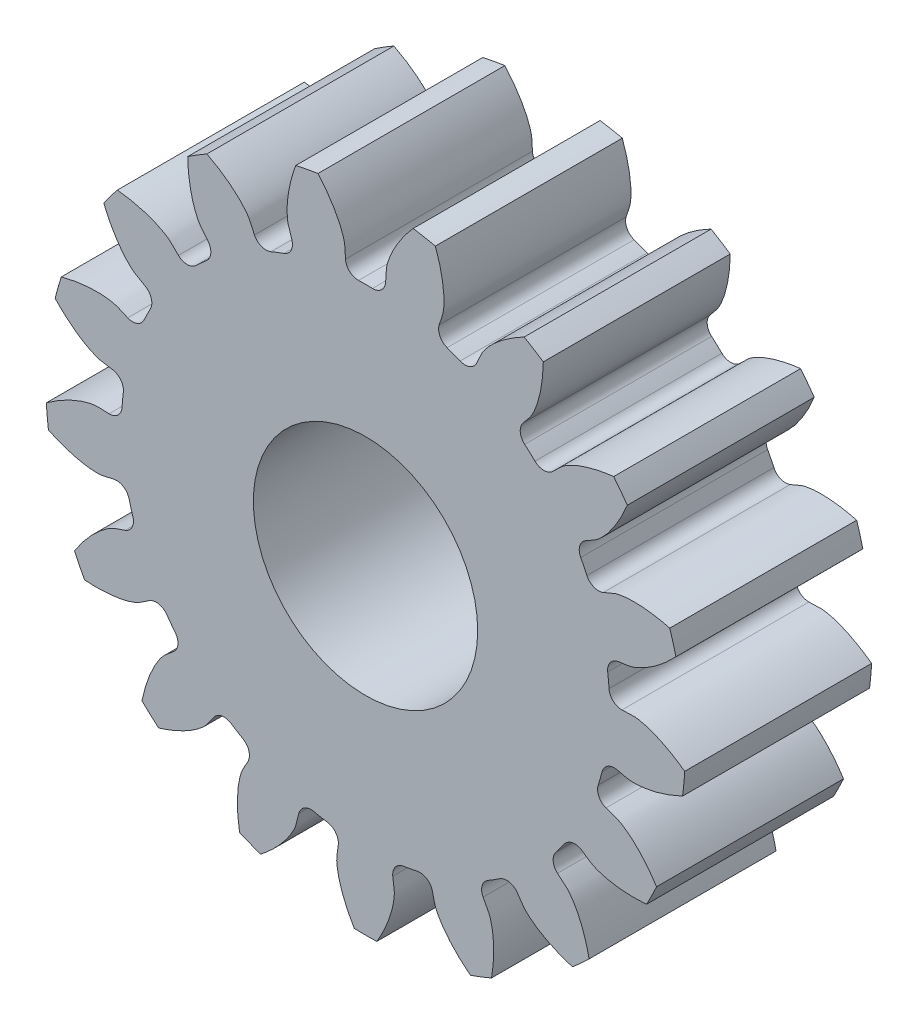
from build123d import *

# Parameters (mm, degrees)
SKETCH_1_R          = 8.55
LASHENA_DEPTH       = 5
CUT_EXTRUDEA_DEPTH  = 5
WWW_KYTOOL_CN_COUNT = 17
SKETCH_3_R          = 3
CUT_EXTRUDE_2_DEPTH = 14.07544674


with BuildPart() as part:
    # 草图1 → LaShenA (new body)
    with BuildSketch(Plane.XY):
        Circle(SKETCH_1_R)
    extrude(amount=LASHENA_DEPTH)

    # SketchA → Cut-ExtrudeA (cut)
    with BuildSketch(Plane.XY.offset(5)):
        with BuildLine():
            ThreePointArc((0.186322137, 6.522339232), (0, 6.525), (-0.186322137, 6.522339232))
            ThreePointArc((-0.186322137, 6.522339232), (-0.425017874, 6.610122801), (-0.53711437, 6.838412058))
            add(Edge.make_bspline(
                [(-0.53711437, 6.838412058), (-0.545439828, 6.948511028), (-0.542307797, 7.082815521), (-0.566647152, 7.226098254), (-0.577998092, 7.272745351), (-0.587968572, 7.309646246), (-0.600719139, 7.351867872), (-0.616514181, 7.399291834), (-0.635675422, 7.451769057), (-0.658498235, 7.50914287), (-0.685278097, 7.571241817), (-0.716301533, 7.637882249), (-0.751848298, 7.708867851), (-0.792190079, 7.783990142), (-0.837590273, 7.863028703), (-0.888303458, 7.945751503), (-0.944574965, 8.031915226), (-1.006640436, 8.121265611), (-1.074725405, 8.213537811), (-1.149044888, 8.308456767), (-1.229802975, 8.405737595), (-1.317192481, 8.505085989), (-1.411394457, 8.606198644), (-1.549059546, 8.74574287), (-1.658974788, 8.847821737), (-1.735531392, 8.915101001)],
                knots=[0.121183801, 0.121183801, 0.121183801, 0.121183801, 0.238205786, 0.264316947, 0.275811996, 0.289397053, 0.305072119, 0.322837193, 0.342692276, 0.364637367, 0.388672467, 0.414797575, 0.443012693, 0.473317818, 0.505712953, 0.540198096, 0.576773247, 0.615438407, 0.656193576, 0.699038754, 0.74397394, 0.790999135, 0.840114338, 0.89131955, 1, 1, 1, 1], degree=3))
            ThreePointArc((-1.735531392, 8.915101001), (0, 9.082460848), (1.735531392, 8.915101001))
            add(Edge.make_bspline(
                [(0.53711437, 6.838412058), (0.545439828, 6.948511028), (0.542307797, 7.082815521), (0.566647152, 7.226098254), (0.577998092, 7.272745351), (0.587968572, 7.309646246), (0.600719139, 7.351867872), (0.616514181, 7.399291834), (0.635675422, 7.451769057), (0.658498235, 7.50914287), (0.685278097, 7.571241817), (0.716301533, 7.637882249), (0.751848298, 7.708867851), (0.792190079, 7.783990142), (0.837590273, 7.863028703), (0.888303458, 7.945751503), (0.944574965, 8.031915226), (1.006640436, 8.121265611), (1.074725405, 8.213537811), (1.149044888, 8.308456767), (1.229802975, 8.405737595), (1.317192481, 8.505085989), (1.411394457, 8.606198644), (1.549059546, 8.74574287), (1.658974788, 8.847821737), (1.735531392, 8.915101001)],
                knots=[0.121183801, 0.121183801, 0.121183801, 0.121183801, 0.238205786, 0.264316947, 0.275811996, 0.289397053, 0.305072119, 0.322837193, 0.342692276, 0.364637367, 0.388672467, 0.414797575, 0.443012693, 0.473317818, 0.505712953, 0.540198096, 0.576773247, 0.615438407, 0.656193576, 0.699038754, 0.74397394, 0.790999135, 0.840114338, 0.89131955, 1, 1, 1, 1], degree=3))
            ThreePointArc((0.53711437, 6.838412058), (0.425017874, 6.610122801), (0.186322137, 6.522339232))
        make_face()
    cut_extrudea = extrude(amount=-CUT_EXTRUDEA_DEPTH, mode=Mode.SUBTRACT)

    # www.KYTool.cn: Cut-ExtrudeA ×17 about axis
    www_kytool_cn_axis = Axis((0, 0, -88.99), (0, 0, 1))
    for i in range(1, WWW_KYTOOL_CN_COUNT):
        add(cut_extrudea.rotate(www_kytool_cn_axis, i * 360 / WWW_KYTOOL_CN_COUNT), mode=Mode.SUBTRACT)

    # 草图3 → 切除-拉伸2 (cut, through all)
    with BuildSketch(Plane.XY.offset(5)):
        Circle(SKETCH_3_R)
    extrude(amount=-CUT_EXTRUDE_2_DEPTH, mode=Mode.SUBTRACT)


solid = part.part
